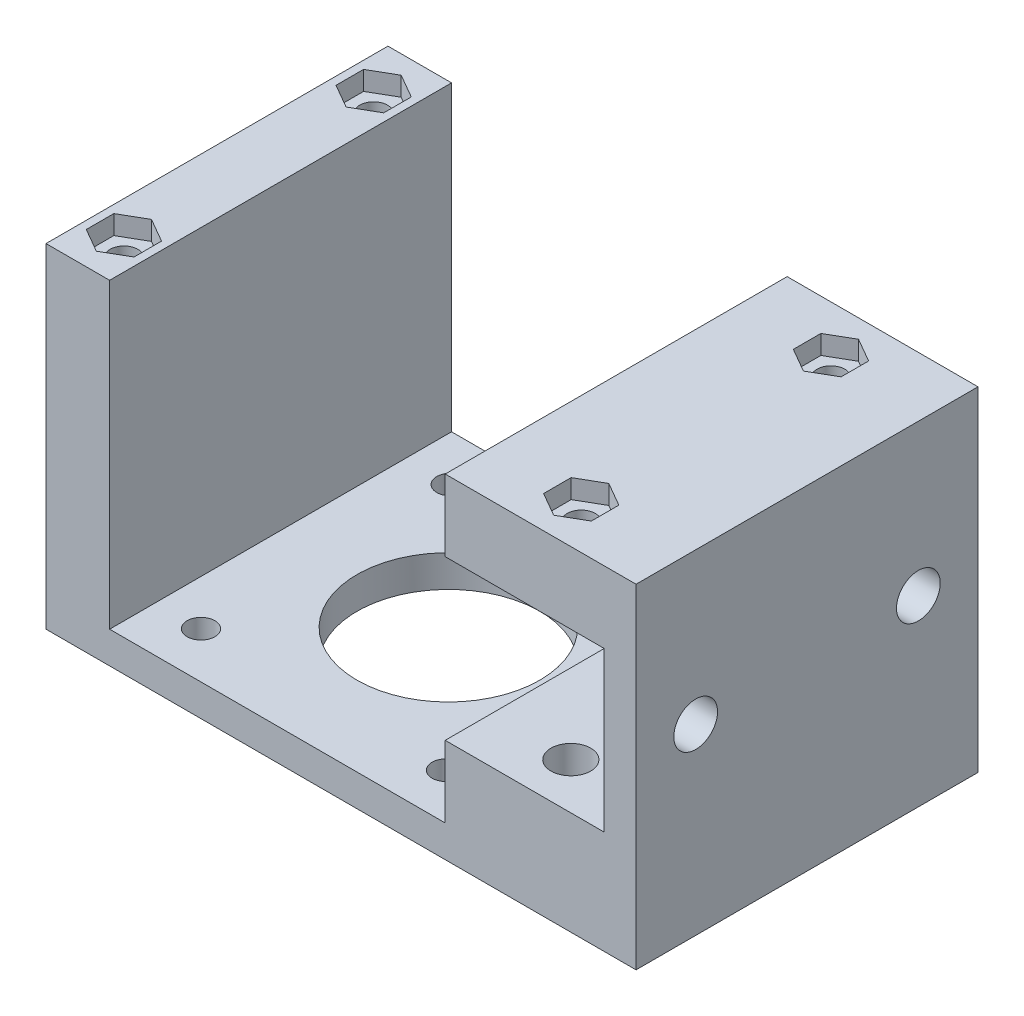
from build123d import *

# Parameters (mm, degrees)
SKETCH1_W           = 74.2
SKETCH1_H           = 46
BOSS_EXTRUDE1_DEPTH = 43
SKETCH2_R           = 11.5
SKETCH2_R_2         = 1.75
SKETCH2_R_3         = 2.5
CUT_EXTRUDE1_DEPTH  = 20
SKETCH3_R           = 3.1
SKETCH3_R_2         = 1.75
CUT_EXTRUDE2_DEPTH  = 15
CUT_EXTRUDE3_DEPTH  = 2.4
SKETCH5_R           = 2.75
CUT_EXTRUDE4_DEPTH  = 12.4


with BuildPart() as part:
    # Sketch1 → Boss-Extrude1 (new body)
    with BuildSketch(Plane.XY):
        with Locations((-13.1, 10)):
            Rectangle(SKETCH1_W, SKETCH1_H)
        Polygon((0, 0), (20, 0), (20, 20), (0, 20), (0, 29), (-42.2, 29), (-42.2, -9), (0, -9), align=None, mode=Mode.SUBTRACT)
    extrude(amount=BOSS_EXTRUDE1_DEPTH)

    # Sketch2 → Cut-Extrude1 (cut)
    with BuildSketch(Plane.XZ.offset(13)):
        with Locations((-21.1, 21.5)):
            Circle(SKETCH2_R)
        with Locations((-36.509600894, 37.201726029)):
            Circle(SKETCH2_R_2)
        with Locations((-5.690399106, 5.798273971)):
            Circle(SKETCH2_R_2)
        with Locations((-36.509600894, 5.798273971)):
            Circle(SKETCH2_R_2)
        with Locations((-5.690399106, 37.201726029)):
            Circle(SKETCH2_R_2)
        with Locations((10, 37.201726029)):
            Circle(SKETCH2_R_3)
        with Locations((10, 5.798273971)):
            Circle(SKETCH2_R_3)
    extrude(amount=-CUT_EXTRUDE1_DEPTH, mode=Mode.SUBTRACT)

    # Sketch3 → Cut-Extrude2 (cut)
    with BuildSketch(Plane(origin=(0, 33, 0), x_dir=(1, 0, 0), z_dir=(0, 1, 0))):
        with Locations(Location((-36.509600894, -5.798273971, 0), (0, 0, 270))):
            Circle(SKETCH3_R)
        with Locations(Location((-5.690399106, -5.798273971, 0), (0, 0, 270))):
            Circle(SKETCH3_R)
        with Locations(Location((-5.690399106, -37.201726029, 0), (0, 0, 270))):
            Circle(SKETCH3_R)
        with Locations(Location((-36.509600894, -37.201726029, 0), (0, 0, 270))):
            Circle(SKETCH3_R)
        with Locations(Location((-46.2, -5.798273971, 0), (0, 0, 270))):
            Circle(SKETCH3_R_2)
        with Locations(Location((-46.2, -37.201726029, 0), (0, 0, 270))):
            Circle(SKETCH3_R_2)
        with Locations(Location((11.309600894, -5.798273971, 0), (0, 0, 270))):
            Circle(SKETCH3_R_2)
        with Locations(Location((11.309600894, -37.201726029, 0), (0, 0, 270))):
            Circle(SKETCH3_R_2)
    extrude(amount=-CUT_EXTRUDE2_DEPTH, mode=Mode.SUBTRACT)


with BuildPart() as body_2:
    # Split1: the piece on the far side of the plane
    add(part.part)
    split(bisect_by=Plane.ZX.offset(29), keep=Keep.BOTTOM)

    # Sketch4 → Cut-Extrude3 (cut)
    with BuildSketch(Plane(origin=(0, 29, 0), x_dir=(1, 0, 0), z_dir=(0, 1, 0))):
        Polygon((-46.2, -2.334172356), (-49.2, -4.066223163), (-49.2, -7.530324778), (-46.2, -9.262375586), (-43.2, -7.530324778), (-43.2, -4.066223163), align=None)
        Polygon((-43.2, -35.469675222), (-46.2, -33.737624414), (-49.2, -35.469675222), (-49.2, -38.933776837), (-46.2, -40.665827644), (-43.2, -38.933776837), align=None)
        Polygon((14.309600894, -4.066223163), (11.309600894, -2.334172356), (8.309600894, -4.066223163), (8.309600894, -7.530324778), (11.309600894, -9.262375586), (14.309600894, -7.530324778), align=None)
        Polygon((14.309600894, -35.469675222), (11.309600894, -33.737624414), (8.309600894, -35.469675222), (8.309600894, -38.933776837), (11.309600894, -40.665827644), (14.309600894, -38.933776837), align=None)
    extrude(amount=-CUT_EXTRUDE3_DEPTH, mode=Mode.SUBTRACT)

    # Sketch5 → Cut-Extrude4 (cut)
    with BuildSketch(Plane(origin=(24, 0, 0), x_dir=(0, 0, -1), z_dir=(1, 0, 0))):
        with Locations(Location((-35.5, 10, 0), (0, 0, 90))):
            Circle(SKETCH5_R)
        with Locations(Location((-7.5, 10, 0), (0, 0, 90))):
            Circle(SKETCH5_R)
    extrude(amount=-CUT_EXTRUDE4_DEPTH, mode=Mode.SUBTRACT)


with BuildPart() as part_1:
    add(part.part)

    # Split1
    split(bisect_by=Plane.ZX.offset(29), keep=Keep.TOP)


solid = body_2.part
